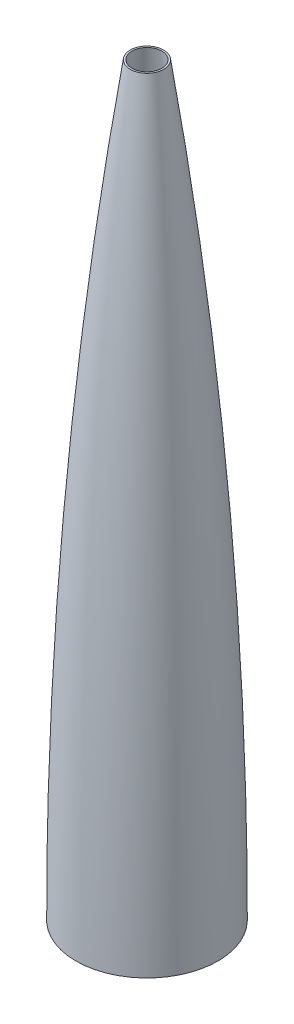
from build123d import *


with BuildPart() as part:
    # Sketch1 → Revolve3 (revolve)
    with BuildSketch(Plane.XY, mode=Mode.PRIVATE) as revolve3_sk:
        with BuildLine():
            Line((-49.53, 0), (-50.8, 0))
            ThreePointArc((-50.8, 0), (-41.079619584, 267.405752277), (-11.969787482, 533.4))
            Line((-11.969787482, 533.4), (-10.686250338, 533.4))
            ThreePointArc((-10.686250338, 533.4), (-39.806221901, 267.406243798), (-49.53, 0))
        make_face()
    revolve(revolve3_sk.sketch.rotate(Axis((0, 609.6, 0), (0, -1, 0)), 270), axis=Axis((0, 609.6, 0), (0, -1, 0)))


solid = part.part
